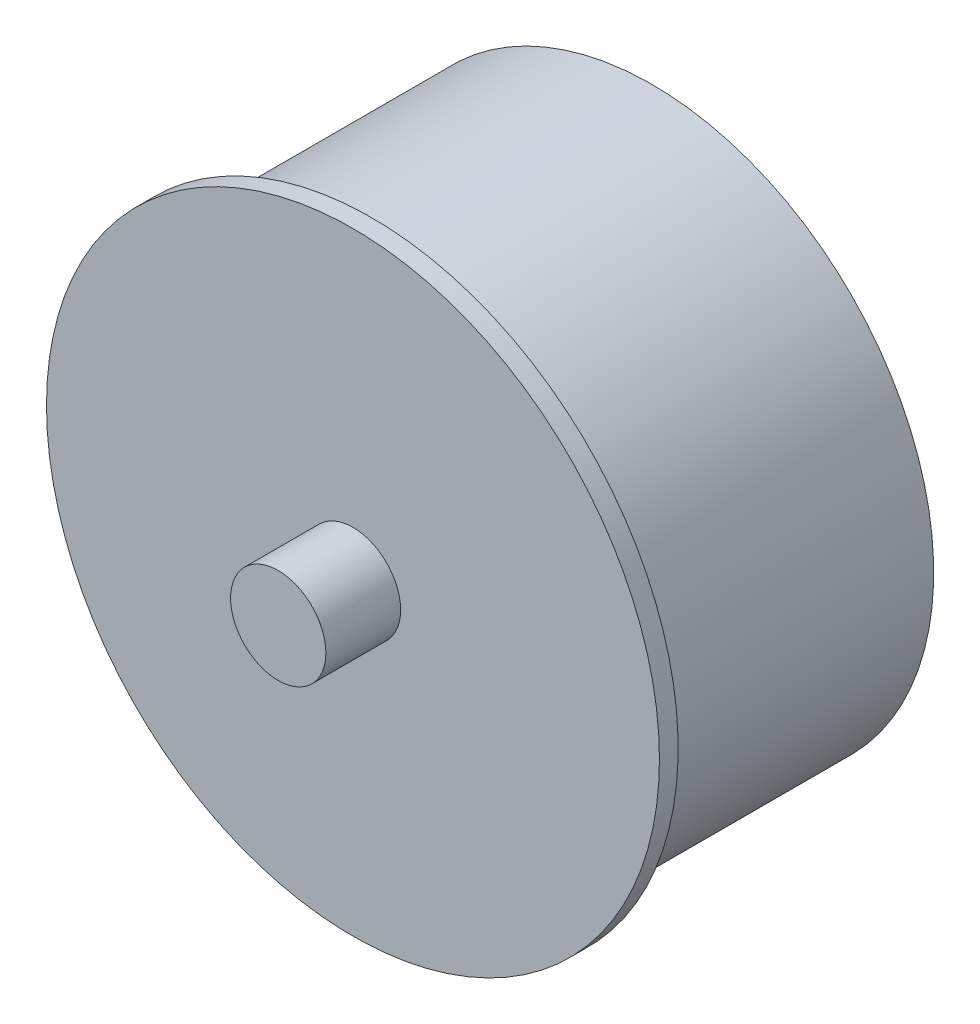
from build123d import *

# Parameters (mm, degrees)
SKETCH_1_R          = 16.4
EXTRUDE_1_DEPTH     = 16
SKETCH_2_R          = 2.55
EXTRUDE_2_DEPTH     = 4
SKETCH_3_R          = 10.075
EXTRUDE_3_DEPTH     = 3
SKETCH_5_R          = 16.4
SKETCH_5_R_2        = 15.075
CUT_EXTRUDE_2_DEPTH = 15
SKETCH_7_R          = 1.05
CUT_EXTRUDE_3_DEPTH = 10


with BuildPart() as part:
    # 草图1 → 凸台-拉伸1 (new body)
    with BuildSketch(Plane.XY):
        Circle(SKETCH_1_R)
    extrude(amount=EXTRUDE_1_DEPTH)

    # 草图2 → 凸台-拉伸2 (add)
    with BuildSketch(Plane.XY.offset(16)):
        Circle(SKETCH_2_R)
    extrude(amount=EXTRUDE_2_DEPTH)

    # 草图5 → 切除-拉伸2 (cut)
    with BuildSketch(Plane(origin=(0, 0, 0), x_dir=(-1, 0, 0), z_dir=(0, 0, -1))):
        Circle(SKETCH_5_R)
        Circle(SKETCH_5_R_2, mode=Mode.SUBTRACT)
    extrude(amount=-CUT_EXTRUDE_2_DEPTH, mode=Mode.SUBTRACT)


with BuildPart() as body_2:
    # 草图3 → 凸台-拉伸3 (new body)
    with BuildSketch(Plane(origin=(0, 0, 0), x_dir=(-1, 0, 0), z_dir=(0, 0, -1))):
        Circle(SKETCH_3_R)
    extrude(amount=EXTRUDE_3_DEPTH)


with BuildPart() as cut_extrude_3_tool:
    # 草图7 → 切除-拉伸3 (new body)
    with BuildSketch(Plane(origin=(0, 0, -3), x_dir=(-1, 0, 0), z_dir=(0, 0, -1))):
        with Locations((0, 8)):
            Circle(SKETCH_7_R)
        with Locations((8, 0)):
            Circle(SKETCH_7_R)
        with Locations((0, -8)):
            Circle(SKETCH_7_R)
        with Locations((-8, 0)):
            Circle(SKETCH_7_R)
    extrude(amount=-CUT_EXTRUDE_3_DEPTH)


with BuildPart() as part_1:
    add(part.part)

    # 切除-拉伸3: cut by cut_extrude_3_tool
    add(cut_extrude_3_tool.part, mode=Mode.SUBTRACT)


with BuildPart() as body_2_1:
    add(body_2.part)

    # 切除-拉伸3: cut by cut_extrude_3_tool
    add(cut_extrude_3_tool.part, mode=Mode.SUBTRACT)


solid = Compound([part_1.part, body_2_1.part])
